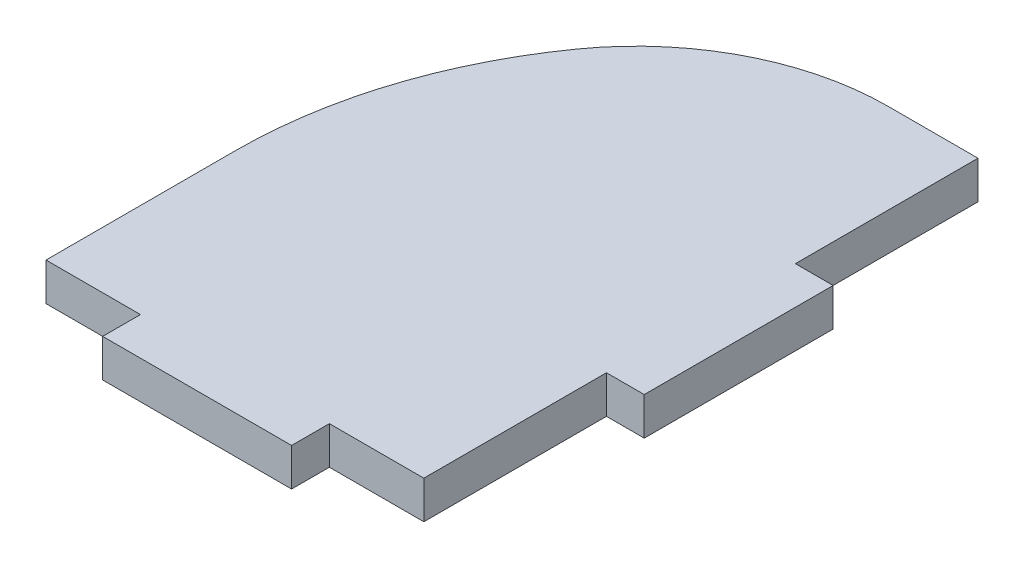
from build123d import *

# Parameters (mm, degrees)
SKETCH1_W           = 30
SKETCH1_H           = 44
BOSS_EXTRUDE1_DEPTH = 3
CUT_EXTRUDE1_DEPTH  = 27.795522014
SKETCH3_W           = 15
SKETCH3_H           = 3
SKETCH3_W_2         = 3
SKETCH3_H_2         = 15
BOSS_EXTRUDE2_DEPTH = 3
FILLET1_R           = 20


with BuildPart() as part:
    # Sketch1 → Boss-Extrude1 (new body)
    with BuildSketch(Plane(origin=(0, 0, 0), x_dir=(1, 0, 0), z_dir=(0, 1, 0))):
        Rectangle(SKETCH1_W, SKETCH1_H)
    extrude(amount=BOSS_EXTRUDE1_DEPTH)

    # Sketch2 → Cut-Extrude1 (cut, through all)
    with BuildSketch(Plane(origin=(0, 3, 0), x_dir=(1, 0, 0), z_dir=(0, 1, 0))):
        with BuildLine():
            Line((-15, -7), (-15, 22))
            Line((-15, 22), (0, 22))
            ThreePointArc((0, 22), (-11.028000253, 9.324827717), (-15, -7))
        make_face()
    extrude(amount=-CUT_EXTRUDE1_DEPTH, mode=Mode.SUBTRACT)

    # Sketch3 → Boss-Extrude2 (add)
    with BuildSketch(Plane(origin=(0, 3, 0), x_dir=(1, 0, 0), z_dir=(0, 1, 0))):
        with Locations((0, -23.5)):
            Rectangle(SKETCH3_W, SKETCH3_H)
        with Locations((16.5, 0)):
            Rectangle(SKETCH3_W_2, SKETCH3_H_2)
    extrude(amount=-BOSS_EXTRUDE2_DEPTH)

    # Fillet1
    fillet1_edges = [part.edges().sort_by_distance(p)[0] for p in [
        (0, 1.5, -22),
    ]]
    fillet(fillet1_edges, radius=FILLET1_R)


solid = part.part
